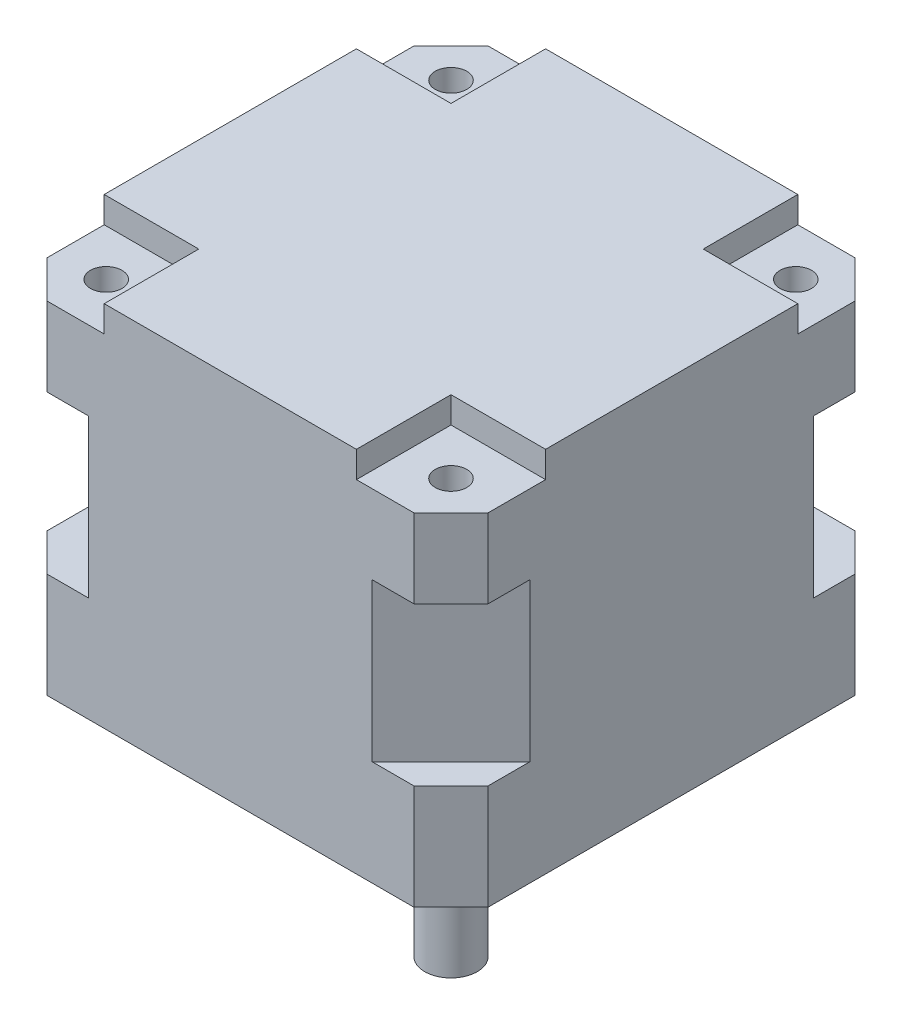
from build123d import *

# Parameters (mm, degrees)
BOSS_EXTRUDE1_DEPTH = 10
BOSS_EXTRUDE2_DEPTH = 15
BOSS_EXTRUDE3_DEPTH = 10
CUT_EXTRUDE1_DEPTH  = 2.5
SKETCH5_R           = 1.5
CUT_EXTRUDE2_DEPTH  = 3
CUT_EXTRUDE3_START  = -2
SKETCH6_R           = 16
SKETCH6_R_2         = 1.5
CUT_EXTRUDE3_DEPTH  = 2
SKETCH7_R           = 10
BOSS_EXTRUDE4_DEPTH = 2.3
SKETCH8_R           = 2.5
BOSS_EXTRUDE5_DEPTH = 23


with BuildPart() as part:
    # Sketch1 → Boss-Extrude1 (new body)
    with BuildSketch(Plane(origin=(0, 0, 0), x_dir=(1, 0, 0), z_dir=(0, 1, 0))):
        Polygon((-17.464466094, 21), (17.464466094, 21), (21, 17.464466094), (21, -17.464466094), (17.464466094, -21), (-17.464466094, -21), (-21, -17.464466094), (-21, 17.464466094), align=None)
    extrude(amount=BOSS_EXTRUDE1_DEPTH)

    # Sketch2 → Boss-Extrude2 (add)
    with BuildSketch(Plane(origin=(0, 10, 0), x_dir=(1, 0, 0), z_dir=(0, 1, 0))):
        Polygon((-13.5, 21), (13.5, 21), (21, 13.5), (21, -13.5), (13.5, -21), (-13.5, -21), (-21, -13.5), (-21, 13.5), align=None)
    extrude(amount=BOSS_EXTRUDE2_DEPTH)

    # Sketch3 → Boss-Extrude3 (add)
    with BuildSketch(Plane(origin=(0, 25, 0), x_dir=(1, 0, 0), z_dir=(0, 1, 0))):
        Polygon((-17.464466094, 21), (17.464466094, 21), (21, 17.464466094), (21, -17.464466094), (17.464466094, -21), (-17.464466094, -21), (-21, -17.464466094), (-21, 17.464466094), align=None)
    extrude(amount=BOSS_EXTRUDE3_DEPTH)

    # Sketch4 → Cut-Extrude1 (cut)
    with BuildSketch(Plane(origin=(0, 35, 0), x_dir=(1, 0, 0), z_dir=(0, 1, 0))):
        Polygon((-12, 12), (-21, 12), (-21, 17.464466094), (-17.464466094, 21), (-12, 21), align=None)
        Polygon((12, 21), (12, 12), (21, 12), (21, 17.464466094), (17.464466094, 21), align=None)
        Polygon((12, -12), (21, -12), (21, -17.464466094), (17.464466094, -21), (12, -21), align=None)
        Polygon((-12, -21), (-12, -12), (-21, -12), (-21, -17.464466094), (-17.464466094, -21), align=None)
    extrude(amount=-CUT_EXTRUDE1_DEPTH, mode=Mode.SUBTRACT)

    # Sketch5 → Cut-Extrude2 (cut)
    with BuildSketch(Plane(origin=(0, 32.5, 0), x_dir=(1, 0, 0), z_dir=(0, 1, 0))):
        with Locations(Location((16.403805922, 16.403805922, 0), (0, 0, 270))):
            Circle(SKETCH5_R)
        with Locations(Location((-16.403805922, 16.403805922, 0), (0, 0, 90))):
            Circle(SKETCH5_R)
        with Locations(Location((-16.403805922, -16.403805922, 0), (0, 0, 270))):
            Circle(SKETCH5_R)
        with Locations(Location((16.403805922, -16.403805922, 0), (0, 0, 90))):
            Circle(SKETCH5_R)
    extrude(amount=-CUT_EXTRUDE2_DEPTH, mode=Mode.SUBTRACT)

    # Sketch6 → Cut-Extrude3 (cut)
    with BuildSketch(Plane.XZ.offset(CUT_EXTRUDE3_START)):
        with Locations(Location((0, 0, 0), (0, 0, 270))):
            Circle(SKETCH6_R)
        with Locations(Location((-16.403805922, -16.403805922, 0), (0, 0, 270))):
            Circle(SKETCH6_R_2)
        with Locations(Location((16.403805922, -16.403805922, 0), (0, 0, 90))):
            Circle(SKETCH6_R_2)
        with Locations(Location((-16.403805922, 16.403805922, 0), (0, 0, 90))):
            Circle(SKETCH6_R_2)
        with Locations(Location((16.403805922, 16.403805922, 0), (0, 0, 270))):
            Circle(SKETCH6_R_2)
    extrude(amount=CUT_EXTRUDE3_DEPTH, mode=Mode.SUBTRACT)

    # Sketch7 → Boss-Extrude4 (add)
    with BuildSketch(Plane.XZ.offset(-2)):
        with Locations(Location((0, 0, 0), (0, 0, 270))):
            Circle(SKETCH7_R)
    extrude(amount=BOSS_EXTRUDE4_DEPTH)

    # Sketch8 → Boss-Extrude5 (add)
    with BuildSketch(Plane.XZ.offset(0.3)):
        with Locations(Location((0, 0, 0), (0, 0, 270))):
            Circle(SKETCH8_R)
    extrude(amount=BOSS_EXTRUDE5_DEPTH)


solid = part.part
